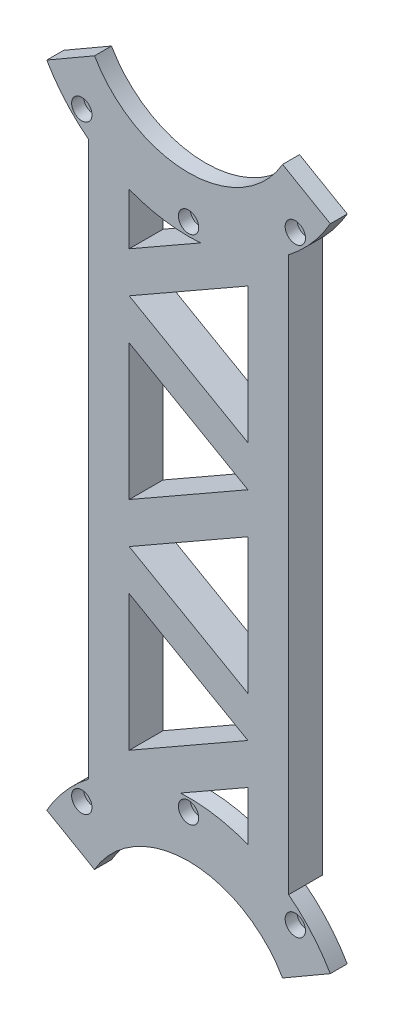
from build123d import *

# Parameters (mm, degrees)
SKETCH1_R           = 48.25
BOSS_EXTRUDE1_DEPTH = 10
SKETCH2_W           = 17.162038191
SKETCH2_H           = 56.822210482
SKETCH2_W_2         = 16.152506533
SKETCH2_H_2         = 65.186901365
CUT_EXTRUDE1_DEPTH  = 8
SKETCH3_R           = 32
CUT_EXTRUDE2_DEPTH  = 10
SKETCH4_R           = 1.75
CUT_EXTRUDE3_DEPTH  = 10
SKETCH9_R           = 3
CUT_EXTRUDE4_DEPTH  = 3.5
SKETCH12_R          = 48.25
BOSS_EXTRUDE4_DEPTH = 10
SKETCH13_W          = 17.162038191
SKETCH13_H          = 240.265998925
SKETCH13_W_2        = 16.152506533
SKETCH13_H_2        = 226.18217938
CUT_EXTRUDE5_DEPTH  = 5
SKETCH14_R          = 30
CUT_EXTRUDE6_DEPTH  = 10
CUT_EXTRUDE7_DEPTH  = 10
CUT_EXTRUDE8_DEPTH  = 10
SKETCH19_R          = 1.75
CUT_EXTRUDE9_DEPTH  = 10
BOSS_EXTRUDE5_DEPTH = 10
SKETCH21_R          = 32
CUT_EXTRUDE11_DEPTH = 10
SKETCH23_R          = 3
CUT_EXTRUDE13_DEPTH = 3.5
CUT_EXTRUDE14_START = -5
SKETCH24_R          = 48.25
CUT_EXTRUDE14_DEPTH = 5


with BuildPart() as part:
    # Sketch1 → Boss-Extrude1 (new body)
    with BuildSketch(Plane.XY):
        Circle(SKETCH1_R)
    extrude(amount=-BOSS_EXTRUDE1_DEPTH)

    # Sketch2 → Cut-Extrude1 (cut)
    with BuildSketch(Plane.XY):
        with Locations((-54.831019095, 0)):
            Rectangle(SKETCH2_W, SKETCH2_H)
        with Locations((54.326253267, -4.182345442)):
            Rectangle(SKETCH2_W_2, SKETCH2_H_2)
    extrude(amount=-CUT_EXTRUDE1_DEPTH, mode=Mode.SUBTRACT)

    # Sketch3 → Cut-Extrude2 (cut)
    with BuildSketch(Plane.XY):
        Circle(SKETCH3_R)
    extrude(amount=-CUT_EXTRUDE2_DEPTH, mode=Mode.SUBTRACT)

    # Sketch4 → Cut-Extrude3 (cut)
    with BuildSketch(Plane.XY):
        with Locations((-42.5, 0)):
            Circle(SKETCH4_R)
        with Locations((0, -44.5)):
            Circle(SKETCH4_R)
        with Locations((0, 44.5)):
            Circle(SKETCH4_R)
        with Locations((42.5, 0)):
            Circle(SKETCH4_R)
        with Locations((-31.466251763, -31.466251763)):
            Circle(SKETCH4_R)
        with Locations((31.466251763, -31.466251763)):
            Circle(SKETCH4_R)
        with Locations((31.466251763, 31.466251763)):
            Circle(SKETCH4_R)
        with Locations((-31.466251763, 31.466251763)):
            Circle(SKETCH4_R)
    extrude(amount=-CUT_EXTRUDE3_DEPTH, mode=Mode.SUBTRACT)

    # Sketch9 → Cut-Extrude4 (cut)
    with BuildSketch(Plane.XY):
        with Locations((-42.5, 0)):
            Circle(SKETCH9_R)
        with Locations((42.5, 0)):
            Circle(SKETCH9_R)
        with Locations((31.466251763, 31.466251763)):
            Circle(SKETCH9_R)
        with Locations((-31.466251763, 31.466251763)):
            Circle(SKETCH9_R)
        with Locations((-31.466251763, -31.466251763)):
            Circle(SKETCH9_R)
        with Locations((31.466251763, -31.466251763)):
            Circle(SKETCH9_R)
        with Locations((0, -44.5)):
            Circle(SKETCH9_R)
        with Locations((0, 44.5)):
            Circle(SKETCH9_R)
    extrude(amount=-CUT_EXTRUDE4_DEPTH, mode=Mode.SUBTRACT)

    # Sketch17 → Cut-Extrude7 (cut)
    with BuildSketch(Plane.XY):
        Polygon((0, 0), (-69.304284442, 39.961433382), (-69.278270797, -65.322297693), (63.970930278, -62.407226987), (69.259758702, 40.038554227), align=None)
    extrude(amount=-CUT_EXTRUDE7_DEPTH, mode=Mode.SUBTRACT)



with BuildPart() as body_2:
    # Sketch12 → Boss-Extrude4 (new body)
    with BuildSketch(Plane.XY):
        with Locations((0, 239.694162197)):
            Circle(SKETCH12_R)
    extrude(amount=-BOSS_EXTRUDE4_DEPTH)

    # Sketch13 → Cut-Extrude5 (cut)
    with BuildSketch(Plane.XY):
        with Locations((-54.831019095, 316.834631882)):
            Rectangle(SKETCH13_W, SKETCH13_H)
        with Locations((54.326253267, 300.281083797)):
            Rectangle(SKETCH13_W_2, SKETCH13_H_2)
    extrude(amount=-CUT_EXTRUDE5_DEPTH, mode=Mode.SUBTRACT)

    # Sketch14 → Cut-Extrude6 (cut)
    with BuildSketch(Plane.XY):
        with Locations((0, 239.694162197)):
            Circle(SKETCH14_R)
    extrude(amount=-CUT_EXTRUDE6_DEPTH, mode=Mode.SUBTRACT)

    # Sketch18 → Cut-Extrude8 (cut)
    with BuildSketch(Plane.XY):
        Polygon((0, 239.694162197), (-69.284269814, 199.69803793), (-69.066382196, 357.511219566), (54.70167511, 362.333351669), (69.279794575, 199.690286588), align=None)
    extrude(amount=-CUT_EXTRUDE8_DEPTH, mode=Mode.SUBTRACT)

    # Sketch19 → Cut-Extrude9 (cut)
    with BuildSketch(Plane.XY):
        with Locations((0, 195.194162197)):
            Circle(SKETCH19_R)
        with Locations((-31.466251763, 208.227910434)):
            Circle(SKETCH19_R)
        with Locations((31.466251763, 208.227910434)):
            Circle(SKETCH19_R)
    extrude(amount=-CUT_EXTRUDE9_DEPTH, mode=Mode.SUBTRACT)


with BuildPart() as part_1:
    add(part.part)

    add(body_2.part)  # Boss-Extrude5 merges body 2
    # Sketch10 → Boss-Extrude5 (add)
    with BuildSketch(Plane.XY):
        with BuildLine():
            Line((-17.5, 179.53997423), (-17.5, 194.729592811))
            ThreePointArc((-17.5, 194.729592811), (-23.743486454, 197.690479608), (-29.5, 201.512851323))
            Line((-29.5, 201.512851323), (-29.5, 38.181310873))
            ThreePointArc((-29.5, 38.181310873), (-16.697131744, 45.268844601), (-2.358379682, 48.192328697))
            Line((-2.358379682, 48.192328697), (17.5, 59.53997423))
            Line((17.5, 59.53997423), (17.5, 44.964569385))
            ThreePointArc((17.5, 44.964569385), (23.743486454, 42.003682588), (29.5, 38.181310873))
            Line((29.5, 38.181310873), (29.5, 201.512851323))
            ThreePointArc((29.5, 201.512851323), (17.261915402, 194.637655711), (3.562842942, 191.575884483))
            Line((3.562842942, 191.575884483), (-17.5, 179.53997423))
        make_face()
        Polygon((17.5, 187.53997423), (17.5, 147.53997423), (-17.5, 167.53997423), align=None, mode=Mode.SUBTRACT)
        Polygon((17.5, 135.53997423), (-17.5, 115.53997423), (-17.5, 155.53997423), align=None, mode=Mode.SUBTRACT)
        Polygon((17.5, 123.53997423), (17.5, 83.53997423), (-17.5, 103.53997423), align=None, mode=Mode.SUBTRACT)
        Polygon((17.5, 71.53997423), (-17.5, 51.53997423), (-17.5, 91.53997423), align=None, mode=Mode.SUBTRACT)
    extrude(amount=-BOSS_EXTRUDE5_DEPTH)

    # Sketch21 → Cut-Extrude11 (cut)
    with BuildSketch(Plane.XY):
        with Locations((0, 239.694162197)):
            Circle(SKETCH21_R)
    extrude(amount=-CUT_EXTRUDE11_DEPTH, mode=Mode.SUBTRACT)

    # Sketch23 → Cut-Extrude13 (cut)
    with BuildSketch(Plane.XY):
        with Locations((-31.466251763, 208.227910434)):
            Circle(SKETCH23_R)
        with Locations((0, 195.194162197)):
            Circle(SKETCH23_R)
        with Locations((31.466251763, 208.227910434)):
            Circle(SKETCH23_R)
        with Locations((0, 44.5)):
            Circle(SKETCH23_R)
    extrude(amount=-CUT_EXTRUDE13_DEPTH, mode=Mode.SUBTRACT)

    # Sketch24 → Cut-Extrude14 (cut)
    with BuildSketch(Plane(origin=(0, 0, -10), x_dir=(-1, 0, 0), z_dir=(0, 0, -1)).offset(CUT_EXTRUDE14_START)):
        with Locations((0, 239.694162197)):
            Circle(SKETCH24_R)
        Circle(SKETCH24_R)
    extrude(amount=CUT_EXTRUDE14_DEPTH, mode=Mode.SUBTRACT)


solid = part_1.part
